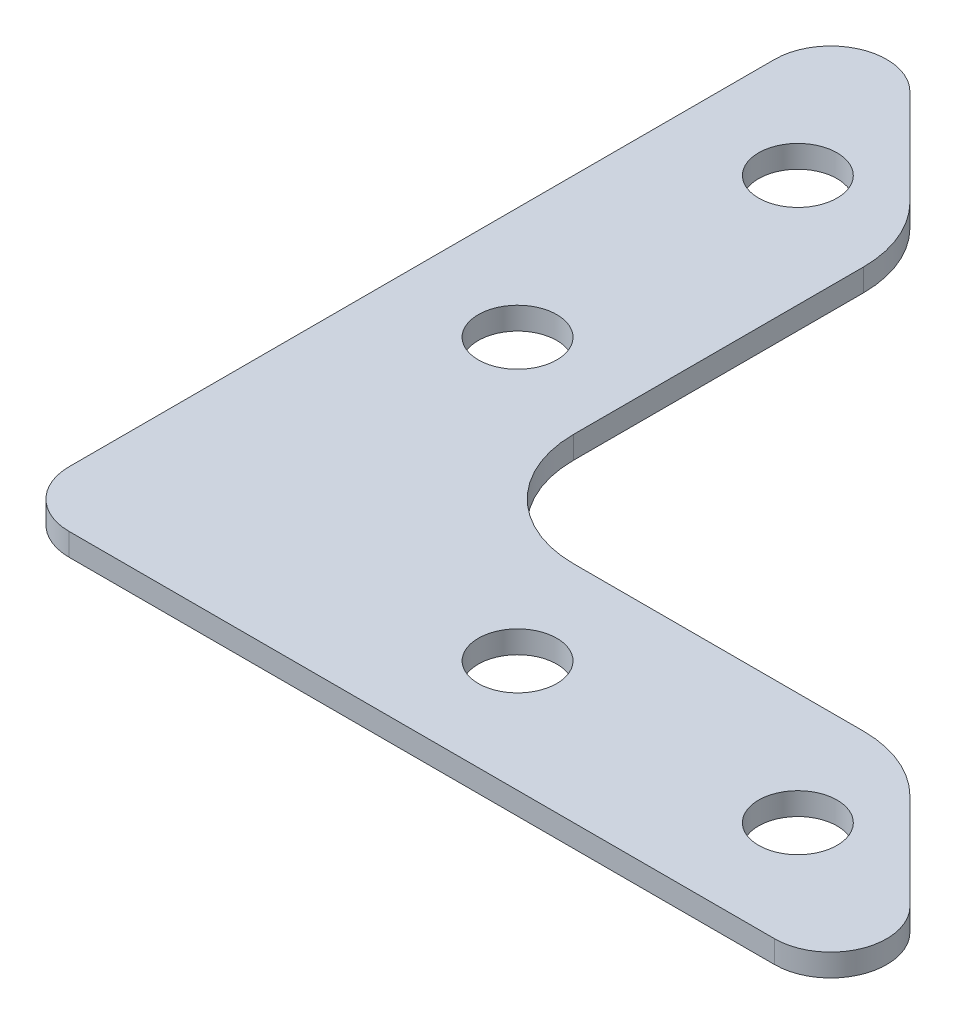
from build123d import *

# Parameters (mm, degrees)
SKETCH1_R           = 3.5
BOSS_EXTRUDE1_DEPTH = 2


with BuildPart() as part:
    # Sketch1 → Boss-Extrude1 (new body)
    with BuildSketch(Plane(origin=(0, 0, 0), x_dir=(1, 0, 0), z_dir=(0, 1, 0))):
        with BuildLine():
            Line((0, 5), (0, 67.928932188))
            ThreePointArc((0, 67.928932188), (3.086582838, 72.548329851), (8.535533906, 71.464466094))
            Line((8.535533906, 71.464466094), (17.071067812, 62.928932188))
            ThreePointArc((17.071067812, 62.928932188), (19.238795325, 59.6846987), (20, 55.857864376))
            Line((20, 55.857864376), (20, 30))
            ThreePointArc((20, 30), (22.928932188, 22.928932188), (30, 20))
            Line((30, 20), (55.857864376, 20))
            ThreePointArc((55.857864376, 20), (59.6846987, 19.238795325), (62.928932188, 17.071067812))
            Line((62.928932188, 17.071067812), (71.464466094, 8.535533906))
            ThreePointArc((71.464466094, 8.535533906), (72.548329851, 3.086582838), (67.928932188, 0))
            Line((67.928932188, 0), (5, 0))
            ThreePointArc((5, 0), (1.464466094, 1.464466094), (0, 5))
        make_face()
        with Locations(Location((10, 60, 0), (0, 0, 270))):
            Circle(SKETCH1_R, mode=Mode.SUBTRACT)
        with Locations(Location((10, 35, 0), (0, 0, 270))):
            Circle(SKETCH1_R, mode=Mode.SUBTRACT)
        with Locations(Location((35, 10, 0), (0, 0, 270))):
            Circle(SKETCH1_R, mode=Mode.SUBTRACT)
        with Locations(Location((60, 10, 0), (0, 0, 270))):
            Circle(SKETCH1_R, mode=Mode.SUBTRACT)
    extrude(amount=BOSS_EXTRUDE1_DEPTH)


solid = part.part
